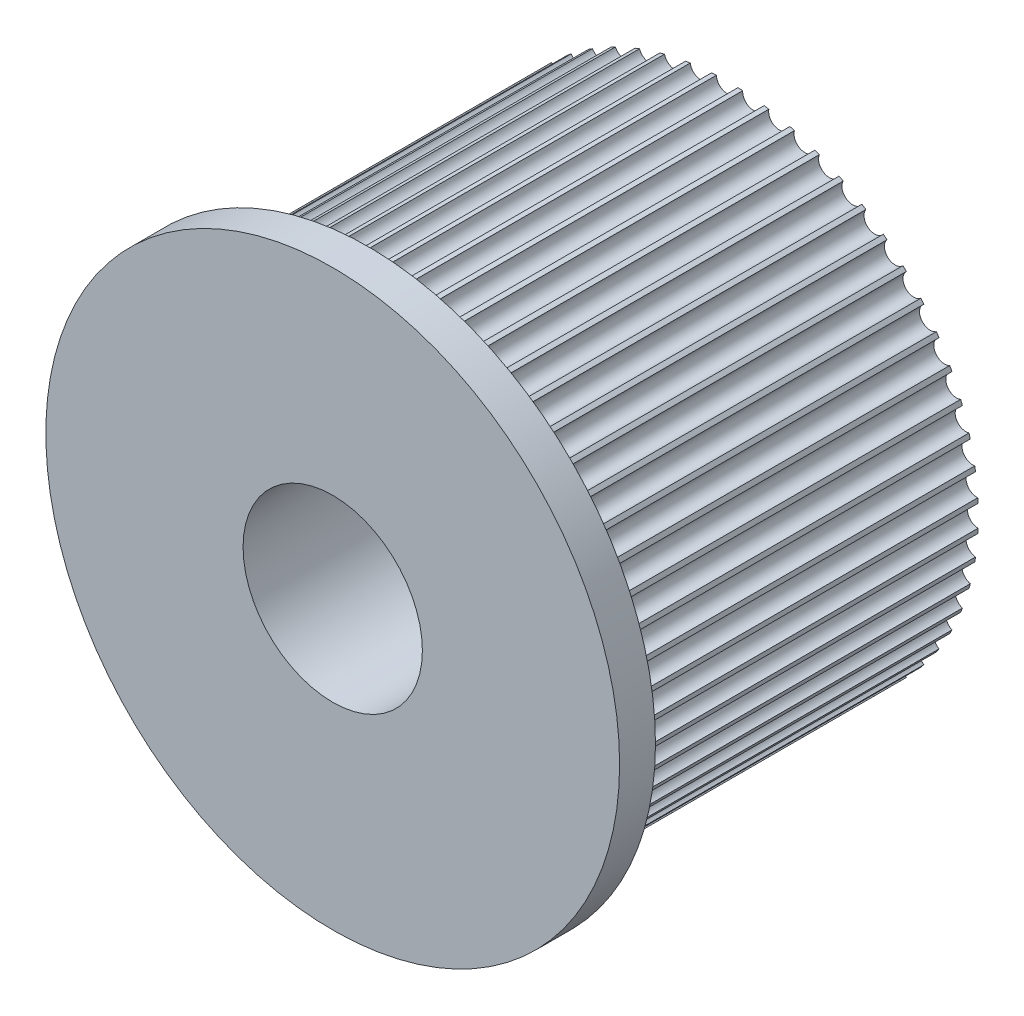
from build123d import *

# Parameters (mm, degrees)
SKETCH1_R           = 7
BOSS_EXTRUDE1_DEPTH = 10
SKETCH2_R           = 8
BOSS_EXTRUDE2_DEPTH = 1
SKETCH3_R           = 2.5
CUT_EXTRUDE1_DEPTH  = 17
SKETCH4_R           = 0.3
CUT_EXTRUDE2_DEPTH  = 10
CIRPATTERN1_COUNT   = 60


with BuildPart() as part:
    # Sketch1 → Boss-Extrude1 (new body)
    with BuildSketch(Plane.XY):
        Circle(SKETCH1_R)
    extrude(amount=BOSS_EXTRUDE1_DEPTH)

    # Sketch2 → Boss-Extrude2 (add)
    with BuildSketch(Plane.XY.offset(10)):
        Circle(SKETCH2_R)
    extrude(amount=BOSS_EXTRUDE2_DEPTH)

    # Sketch3 → Cut-Extrude1 (cut)
    with BuildSketch(Plane(origin=(0, 0, 0), x_dir=(-1, 0, 0), z_dir=(0, 0, -1))):
        Circle(SKETCH3_R)
    extrude(amount=-CUT_EXTRUDE1_DEPTH, mode=Mode.SUBTRACT)

    # Sketch4 → Cut-Extrude2 (cut)
    with BuildSketch(Plane(origin=(0, 0, 0), x_dir=(-1, 0, 0), z_dir=(0, 0, -1))):
        with Locations((0, 7)):
            Circle(SKETCH4_R)
    cut_extrude2 = extrude(amount=-CUT_EXTRUDE2_DEPTH, mode=Mode.SUBTRACT)

    # CirPattern1: Cut-Extrude2 ×60 about axis
    cirpattern1_axis = Axis((0, 0, 0), (0, 0, 1))
    for i in range(1, CIRPATTERN1_COUNT):
        add(cut_extrude2.rotate(cirpattern1_axis, i * 360 / CIRPATTERN1_COUNT), mode=Mode.SUBTRACT)


solid = part.part
